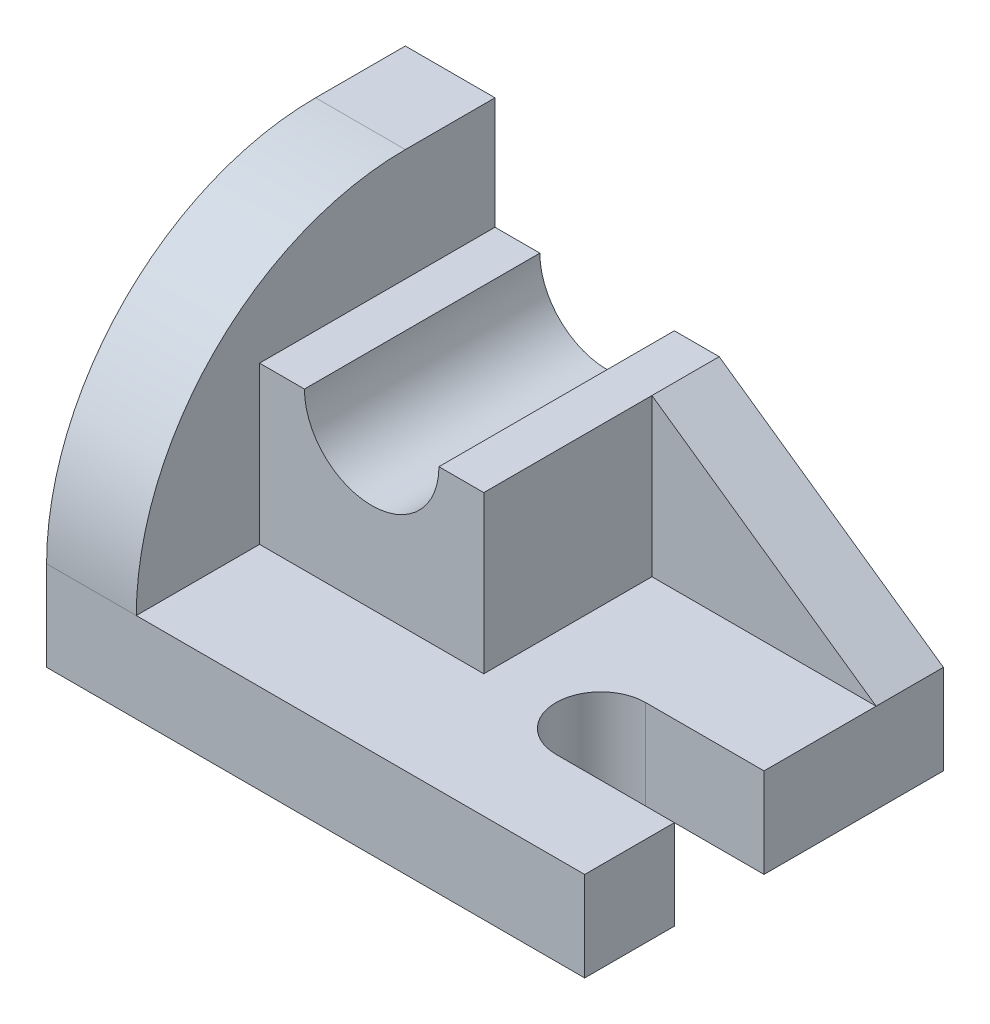
from build123d import *

# Parameters (mm, degrees)
BOSS_EXTRUDE1_DEPTH = 40.64
BOSS_EXTRUDE2_DEPTH = 121.92
BOSS_EXTRUDE3_DEPTH = 71.12
CHAMFER1_SIZE       = 71.12
CHAMFER1_SIZE2      = 101.6
FILLET1_R           = 121.92
CUT_EXTRUDE1_DEPTH  = 106.68


with BuildPart() as part:
    # Sketch1 → Boss-Extrude1 (new body)
    with BuildSketch(Plane(origin=(0, 0, 0), x_dir=(1, 0, 0), z_dir=(0, 1, 0))):
        with BuildLine():
            Line((186.601289805, 121.92), (-57.238710195, 121.92))
            Line((-57.238710195, 121.92), (-57.238710195, -40.64))
            Line((-57.238710195, -40.64), (186.601289805, -40.64))
            Line((186.601289805, -40.64), (186.601289805, 0))
            Line((186.601289805, 0), (132.948481924, 0))
            ThreePointArc((132.948481924, 0), (112.628481924, 20.32), (132.948481924, 40.64))
            Line((132.948481924, 40.64), (186.601289805, 40.64))
            Line((186.601289805, 40.64), (186.601289805, 121.92))
        make_face()
    extrude(amount=BOSS_EXTRUDE1_DEPTH)

    # Sketch2 → Boss-Extrude2 (add)
    with BuildSketch(Plane(origin=(0, 40.64, 0), x_dir=(1, 0, 0), z_dir=(0, 1, 0))):
        Polygon((-16.598710195, 15.24), (-16.598710195, 121.92), (-57.238710195, 121.92), (-57.238710195, -40.64), (-16.598710195, -40.64), align=None)
    extrude(amount=BOSS_EXTRUDE2_DEPTH)

    # Sketch2<4> → Boss-Extrude3 (add)
    with BuildSketch(Plane(origin=(0, 40.64, 0), x_dir=(1, 0, 0), z_dir=(0, 1, 0))):
        Polygon((-16.598710195, 15.24), (85.001289805, 15.24), (85.001289805, 91.44), (186.601289805, 91.44), (186.601289805, 121.92), (-16.598710195, 121.92), align=None)
    extrude(amount=BOSS_EXTRUDE3_DEPTH)

    # Chamfer1
    chamfer1_edges = [part.edges().sort_by_distance(p)[0] for p in [
        (186.601289805, 111.76, -106.68),
    ]]
    chamfer1_side = [part.faces().sort_by_distance(p)[0] for p in [
        (186.601289805, 20.32, -42.021909404),
    ]]
    chamfer(chamfer1_edges, length=CHAMFER1_SIZE, length2=CHAMFER1_SIZE2, reference=chamfer1_side[0])

    # Fillet1
    fillet1_edges = [part.edges().sort_by_distance(p)[0] for p in [
        (-36.918710195, 162.56, 40.64),
    ]]
    fillet(fillet1_edges, radius=FILLET1_R)

    # Sketch3 → Cut-Extrude1 (cut)
    with BuildSketch(Plane.XY.offset(-15.24)):
        with BuildLine():
            Line((64.681289805, 111.76), (3.721289805, 111.76))
            ThreePointArc((3.721289805, 111.76), (34.201289805, 81.28), (64.681289805, 111.76))
        make_face()
    extrude(amount=-CUT_EXTRUDE1_DEPTH, mode=Mode.SUBTRACT)


solid = part.part
